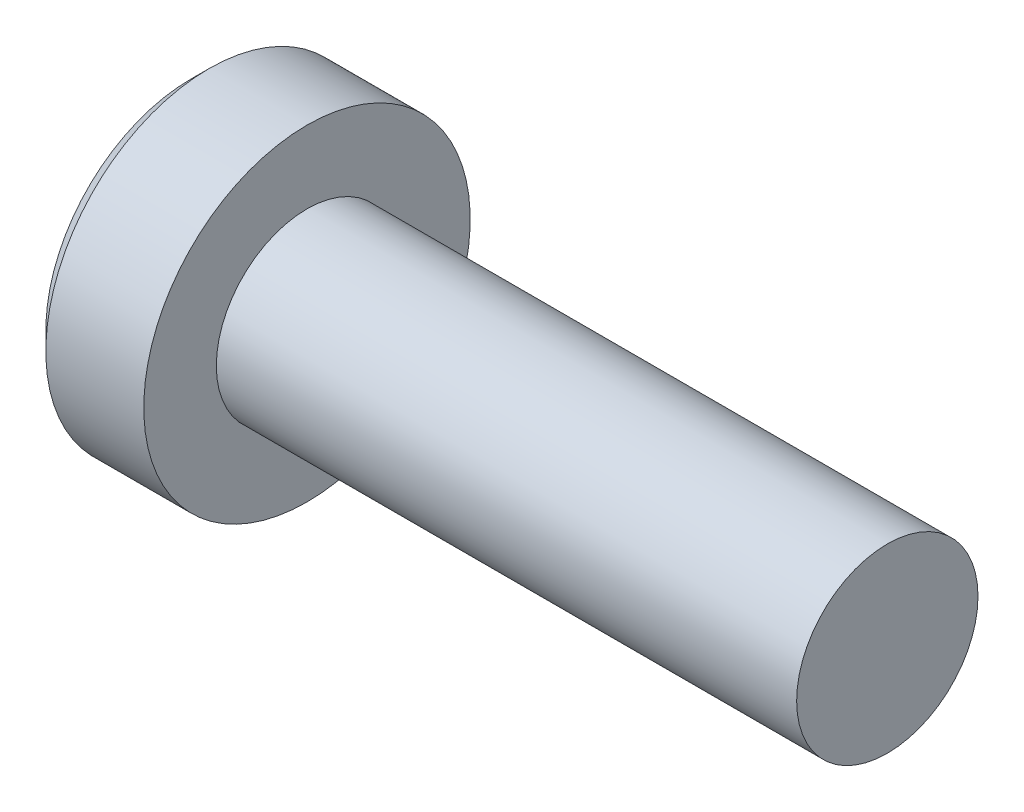
from build123d import *

# Parameters (mm, degrees)
CUT_EXTRUDE1_DEPTH = 1.1
CHAMFER1_SIZE      = 0.25


with BuildPart() as part:
    # Sketch1 → Revolve1 (revolve)
    with BuildSketch(Plane.XY, mode=Mode.PRIVATE) as revolve1_sk:
        Polygon((8, 0), (8, 1.25), (0, 1.25), (0, 2.25), (-1.6, 2.25), (-1.6, 0), align=None)
    revolve(revolve1_sk.sketch.rotate(Axis((-1.6, 0, 0), (1, 0, 0)), 180), axis=Axis((-1.6, 0, 0), (1, 0, 0)))

    # Sketch2 → Cut-Extrude1 (cut)
    with BuildSketch(Plane.ZY.offset(1.6)):
        Polygon((0, 1.154700538), (-1, 0.577350269), (-1, -0.577350269), (0, -1.154700538), (1, -0.577350269), (1, 0.577350269), align=None)
    extrude(amount=-CUT_EXTRUDE1_DEPTH, mode=Mode.SUBTRACT)

    # Sketch3 → Cut-Revolve1 (revolve, cut)
    with BuildSketch(Plane.XY, mode=Mode.PRIVATE) as cut_revolve1_sk:
        Polygon((0.077350269, 0), (-0.5, 1), (-0.5, 0), align=None)
    revolve(cut_revolve1_sk.sketch.rotate(Axis((-0.5, 0, 0), (1, 0, 0)), 180), axis=Axis((-0.5, 0, 0), (1, 0, 0)), mode=Mode.SUBTRACT)

    # Chamfer1
    chamfer1_edges = [part.edges().sort_by_distance(p)[0] for p in [
        (-1.6, 2.25, 0),
    ]]
    chamfer(chamfer1_edges, length=CHAMFER1_SIZE)


solid = part.part
